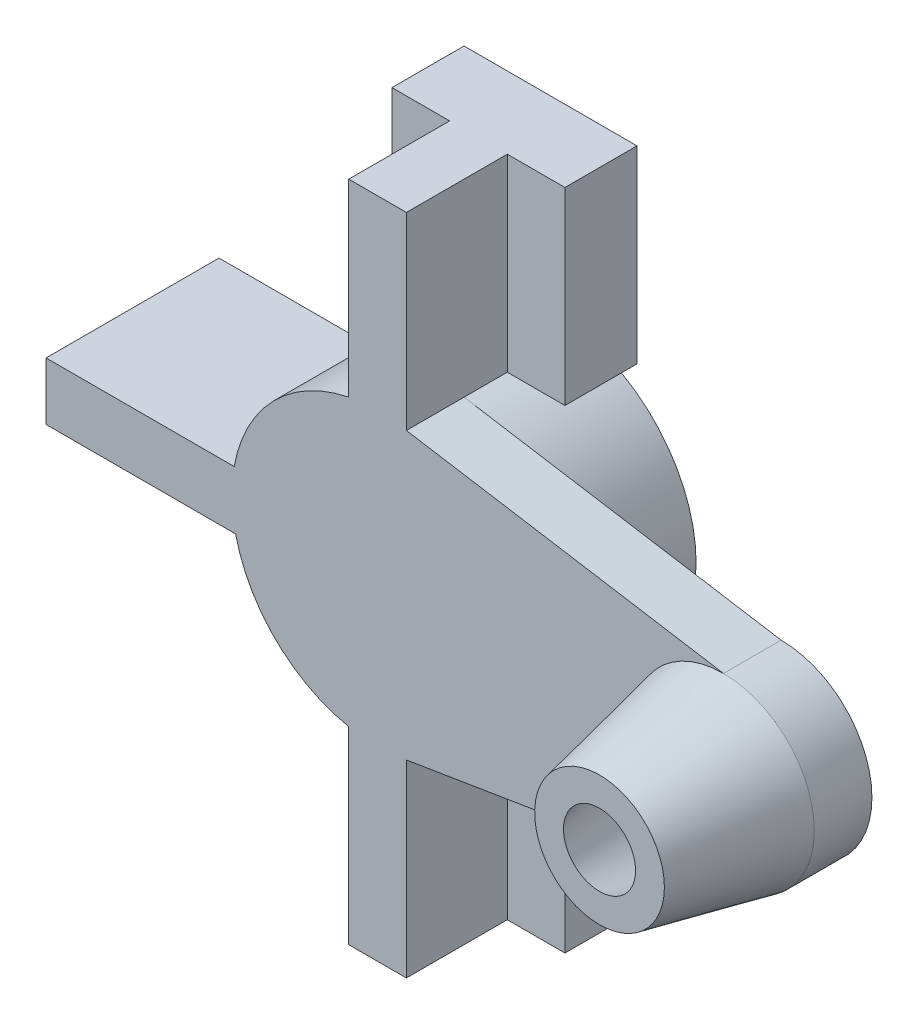
from build123d import *

# Parameters (mm, degrees)
RESSALTO_EXTRUS_O4_DEPTH = 20
RESSALTO_EXTRUS_O5_START = 40
ESBO_O6_R                = 50.5
RESSALTO_EXTRUS_O5_DEPTH = 40
RESSALTO_EXTRUS_O6_START = 40
RESSALTO_EXTRUS_O6_DEPTH = 40
RESSALTO_EXTRUS_O7_START = 40
RESSALTO_EXTRUS_O7_DEPTH = 40
RESSALTO_EXTRUS_O8_START = 40
RESSALTO_EXTRUS_O8_DEPTH = 40
ESBO_O12_W               = 60
ESBO_O12_H               = 65.5
RESSALTO_EXTRUS_O9_DEPTH = 25


with BuildPart() as part:
    # Esboço2 → Ressalto-extrusão4 (new body)
    with BuildSketch(Plane.XY):
        with BuildLine():
            Line((-10, 115), (-10, 49.5))
            ThreePointArc((-10, 49.5), (-36.141814954, 35.270656526), (-49.729212576, 8.789506048))
            Line((-49.729212576, 8.789506048), (-115, 8.789506048))
            Line((-115, 8.789506048), (-115, -11.210493952))
            Line((-115, -11.210493952), (-49.239971825, -11.210493952))
            ThreePointArc((-49.239971825, -11.210493952), (-35.268472235, -36.143946467), (-10, -49.5))
            Line((-10, -49.5), (-10, -115))
            Line((-10, -115), (10, -115))
            Line((10, -115), (10, -49.5))
            Line((10, -49.5), (120, -31.5))
            ThreePointArc((120, -31.5), (151.5, 0), (120, 31.5))
            Line((120, 31.5), (10, 49.5))
            Line((10, 49.5), (10, 115))
            Line((10, 115), (-10, 115))
        make_face()
    extrude(amount=RESSALTO_EXTRUS_O4_DEPTH)

    # Esboço3 → Revolução2 (revolve)
    with BuildSketch(Plane(origin=(0, 0, 0), x_dir=(1, 0, 0), z_dir=(0, 1, 0)), mode=Mode.PRIVATE) as revolu_o2_sk:
        Polygon((120, -63), (120, -20), (151.5, -20), (142.5, -63), align=None)
    revolve(revolu_o2_sk.sketch.rotate(Axis((120, 0, 63), (0, 0, -1)), 90), axis=Axis((120, 0, 63), (0, 0, -1)))

    # Esboço5 → Corte-Revolução1 (revolve, cut)
    with BuildSketch(Plane(origin=(0, 0, 0), x_dir=(1, 0, 0), z_dir=(0, 1, 0)), mode=Mode.PRIVATE) as corte_revolu_o1_sk:
        Polygon((120, -20), (120, -63), (132.5, -63), (142.5, -20), align=None)
    revolve(corte_revolu_o1_sk.sketch.rotate(Axis((120, 0, 20), (0, 0, 1)), 180), axis=Axis((120, 0, 20), (0, 0, 1)), mode=Mode.SUBTRACT)

    # Esboço6 → Ressalto-extrusão5 (add)
    with BuildSketch(Plane(origin=(0, 0, 0), x_dir=(-1, 0, 0), z_dir=(0, 0, -1)).offset(RESSALTO_EXTRUS_O5_START)):
        Circle(ESBO_O6_R)
    extrude(amount=-RESSALTO_EXTRUS_O5_DEPTH)

    # Esboço7 → Ressalto-extrusão6 (add)
    with BuildSketch(Plane(origin=(0, 0, 0), x_dir=(-1, 0, 0), z_dir=(0, 0, -1)).offset(RESSALTO_EXTRUS_O6_START)):
        with BuildLine():
            Line((-10, -49.5), (-10, -115))
            Line((-10, -115), (10, -115))
            Line((10, -115), (10, -49.5))
            ThreePointArc((10, -49.5), (0, -50.5), (-10, -49.5))
        make_face()
    extrude(amount=-RESSALTO_EXTRUS_O6_DEPTH)

    # Esboço8 → Ressalto-extrusão7 (add)
    with BuildSketch(Plane(origin=(0, 0, 0), x_dir=(-1, 0, 0), z_dir=(0, 0, -1)).offset(RESSALTO_EXTRUS_O7_START)):
        with BuildLine():
            Line((10, 49.5), (10, 115))
            Line((10, 115), (-10, 115))
            Line((-10, 115), (-10, 49.5))
            ThreePointArc((-10, 49.5), (0, 50.5), (10, 49.5))
        make_face()
    extrude(amount=-RESSALTO_EXTRUS_O7_DEPTH)

    # Esboço10 → Ressalto-extrusão8 (add)
    with BuildSketch(Plane(origin=(0, 0, 0), x_dir=(-1, 0, 0), z_dir=(0, 0, -1)).offset(RESSALTO_EXTRUS_O8_START)):
        with BuildLine():
            Line((49.239971825, -11.210493952), (115, -11.210493952))
            Line((115, -11.210493952), (115, 8.789506048))
            Line((115, 8.789506048), (49.729212576, 8.789506048))
            ThreePointArc((49.729212576, 8.789506048), (50.484897398, -1.234963456), (49.239971825, -11.210493952))
        make_face()
    extrude(amount=-RESSALTO_EXTRUS_O8_DEPTH)

    # Esboço12 → Ressalto-extrusão9 (add)
    with BuildSketch(Plane(origin=(0, 0, -40), x_dir=(-1, 0, 0), z_dir=(0, 0, -1))):
        with Locations((0, 82.25)):
            Rectangle(ESBO_O12_W, ESBO_O12_H)
        with Locations((0, -82.25)):
            Rectangle(ESBO_O12_W, ESBO_O12_H)
    extrude(amount=-RESSALTO_EXTRUS_O9_DEPTH)


solid = part.part
